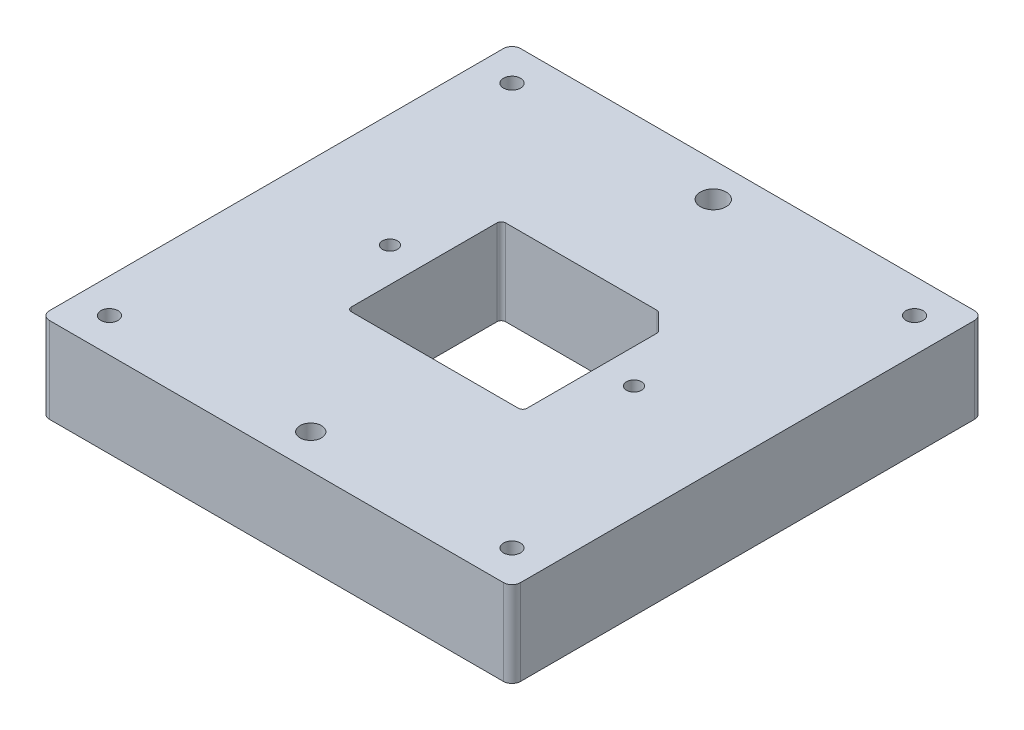
from build123d import *

# Parameters (mm, degrees)
CROQUIS1_W              = 110
CROQUIS1_H              = 110
SALIENTE_EXTRUIR1_DEPTH = 20
REDONDEO1_R             = 2
REDONDEO2_R             = 2
CROQUIS2_R              = 2
CORTAR_EXTRUIR1_DEPTH   = 20
CROQUIS3_R              = 4
CORTAR_EXTRUIR2_DEPTH   = 10
CROQUIS4_R              = 2.5
CROQUIS4_R_2            = 3
CORTAR_EXTRUIR3_DEPTH   = 10
CROQUIS5_R              = 1.75
CORTAR_EXTRUIR4_DEPTH   = 10
CORTAR_EXTRUIR5_DEPTH   = 23
CROQUIS10_R             = 1.75
CORTAR_EXTRUIR6_DEPTH   = 23
CORTAR_EXTRUIR7_DEPTH   = 23
CROQUIS12_R             = 2.5
CROQUIS12_R_2           = 3
CORTAR_EXTRUIR8_DEPTH   = 6
SALIENTE_EXTRUIR2_REACH = 82.312
CROQUIS13_R             = 3.5
CROQUIS14_R             = 1.75
CORTAR_EXTRUIR9_DEPTH   = 20
CROQUIS15_R             = 3
CORTAR_EXTRUIR10_DEPTH  = 6.3
CROQUIS23_R             = 4.917029705
SALIENTE_EXTRUIR4_DEPTH = 20
CROQUIS24_R             = 1.75
CORTAR_EXTRUIR12_DEPTH  = 20
CROQUIS25_R             = 3
CORTAR_EXTRUIR13_DEPTH  = 6.3
CROQUIS26_R             = 3
CORTAR_EXTRUIR14_DEPTH  = 6.3
CORTAR_EXTRUIR15_DEPTH  = 10
CROQUIS28_R             = 1.75
CORTAR_EXTRUIR16_DEPTH  = 20
CROQUIS29_W             = 24.147685667
CROQUIS29_H             = 8.546652792
SALIENTE_EXTRUIR5_DEPTH = 20


with BuildPart() as part:
    # Croquis1 → Saliente-Extruir1 (new body)
    with BuildSketch(Plane(origin=(0, 0, 0), x_dir=(1, 0, 0), z_dir=(0, 1, 0))):
        Rectangle(CROQUIS1_W, CROQUIS1_H)
    extrude(amount=SALIENTE_EXTRUIR1_DEPTH)

    # Redondeo1
    redondeo1_edges = [part.edges().sort_by_distance(p)[0] for p in [
        (55, 10, 55),
    ]]
    fillet(redondeo1_edges, radius=REDONDEO1_R)

    # Redondeo2
    redondeo2_edges = [part.edges().sort_by_distance(p)[0] for p in [
        (-55, 10, 55),
        (-55, 10, -55),
        (55, 10, -55),
    ]]
    fillet(redondeo2_edges, radius=REDONDEO2_R)

    # Croquis2 → Cortar-Extruir1 (cut)
    with BuildSketch(Plane.XZ):
        with Locations(Location((-47, 47, 0), (0, 0, 270))):
            Circle(CROQUIS2_R)
        with Locations(Location((47, 47, 0), (0, 0, 270))):
            Circle(CROQUIS2_R)
        with Locations(Location((47, -47, 0), (0, 0, 270))):
            Circle(CROQUIS2_R)
        with Locations(Location((-47, -47, 0), (0, 0, 270))):
            Circle(CROQUIS2_R)
    extrude(amount=-CORTAR_EXTRUIR1_DEPTH, mode=Mode.SUBTRACT)

    # Croquis3 → Cortar-Extruir2 (cut)
    with BuildSketch(Plane.XZ):
        with Locations(Location((47, 47, 0), (0, 0, 270))):
            Circle(CROQUIS3_R)
        with Locations(Location((-47, 47, 0), (0, 0, 90))):
            Circle(CROQUIS3_R)
        with Locations(Location((-47, -47, 0), (0, 0, 270))):
            Circle(CROQUIS3_R)
        with Locations(Location((47, -47, 0), (0, 0, 90))):
            Circle(CROQUIS3_R)
    extrude(amount=-CORTAR_EXTRUIR2_DEPTH, mode=Mode.SUBTRACT)

    # Croquis4 → Cortar-Extruir3 (cut)
    with BuildSketch(Plane.XZ):
        with Locations(Location((0, 47, 0), (0, 0, 270))):
            Circle(CROQUIS4_R)
        with Locations(Location((1.818078454, -47, 0), (0, 0, 270))):
            Circle(CROQUIS4_R_2)
    extrude(amount=-CORTAR_EXTRUIR3_DEPTH, mode=Mode.SUBTRACT)

    # Croquis5 → Cortar-Extruir4 (cut)
    with BuildSketch(Plane.XZ.offset(-10)):
        with Locations((0, 47)):
            Circle(CROQUIS5_R)
        with Locations((1.818078454, -47)):
            Circle(CROQUIS5_R)
        with BuildLine():
            Line((20.207106781, -14.050252532), (16.550252532, -17.707106781))
            ThreePointArc((16.550252532, -17.707106781), (16.225829183, -17.923879533), (15.843145751, -18))
            Line((15.843145751, -18), (-19.5, -18))
            ThreePointArc((-19.5, -18), (-20.207106781, -17.707106781), (-20.5, -17))
            Line((-20.5, -17), (-20.5, 17))
            ThreePointArc((-20.5, 17), (-20.207106781, 17.707106781), (-19.5, 18))
            Line((-19.5, 18), (19.5, 18))
            ThreePointArc((19.5, 18), (20.207106781, 17.707106781), (20.5, 17))
            Line((20.5, 17), (20.5, -13.343145751))
            ThreePointArc((20.5, -13.343145751), (20.423879533, -13.725829183), (20.207106781, -14.050252532))
        make_face()
    extrude(amount=CORTAR_EXTRUIR4_DEPTH, mode=Mode.SUBTRACT)

    # Croquis8 → Cortar-Extruir5 (cut)
    # profile 1 of 6: a face of its own
    with BuildSketch(Plane(origin=(0, 20, 0), x_dir=(1, 0, 0), z_dir=(0, 1, 0))):
        Polygon((-5.179479891, -37.773450824), (-3.474351686, -37.773450824), (-3.474351686, -38.132425183), (-4.865377327, -38.132425183), (-4.865377327, -39.20934826), (-3.474351686, -39.20934826), (-3.474351686, -39.568322619), (-4.865377327, -39.568322619), (-4.865377327, -41.273450824), (-5.179479891, -41.273450824), align=None)
    # profile 2 of 6: a face of its own
    with BuildSketch(Plane(origin=(0, 20, 0), x_dir=(1, 0, 0), z_dir=(0, 1, 0))):
        with BuildLine():
            Line((-3.025633737, -38.715758517), (-2.711531173, -38.715758517))
            Line((-2.711531173, -38.715758517), (-2.711531173, -39.09226092))
            add(Edge.make_bspline(
                [(-2.711531173, -39.09226092), (-2.688342414, -39.057205092), (-2.643994093, -38.990161093), (-2.570281164, -38.901491792), (-2.494777833, -38.828076745), (-2.417122645, -38.769573226), (-2.336744545, -38.725760108), (-2.255407594, -38.693667073), (-2.171832124, -38.674689757), (-2.1156702, -38.672156098), (-2.087532776, -38.670886722)],
                knots=[0, 0, 0, 0, 1.2804753, 2.448899062, 3.506932113, 4.484331642, 5.4025378, 6.288909075, 7.142734305, 8, 8, 8, 8], degree=3))
            add(Edge.make_bspline(
                [(-2.087532776, -38.670886722), (-2.065706449, -38.672077248), (-2.020797364, -38.674526834), (-1.952814774, -38.691737659), (-1.882771322, -38.719215681), (-1.837628935, -38.745055904), (-1.814095276, -38.758526946)],
                knots=[0, 0, 0, 0, 0.901110191, 1.854092781, 2.881294221, 4, 4, 4, 4], degree=3))
            Line((-1.814095276, -38.758526946), (-1.986571237, -39.030562203))
            add(Edge.make_bspline(
                [(-1.986571237, -39.030562203), (-2.001680258, -39.023821936), (-2.030360073, -39.011027621), (-2.072314639, -38.995885611), (-2.110995976, -38.986969695), (-2.135639534, -38.985618978), (-2.147128128, -38.984989286)],
                knots=[0, 0, 0, 0, 1.180555205, 2.24091978, 3.179933427, 4, 4, 4, 4], degree=3))
            add(Edge.make_bspline(
                [(-2.147128128, -38.984989286), (-2.172333862, -38.986669323), (-2.223746252, -38.990096112), (-2.299230751, -39.01703492), (-2.372477957, -39.06056016), (-2.430649619, -39.108831272), (-2.475691872, -39.15537907), (-2.507832097, -39.196027472), (-2.537314844, -39.241606104), (-2.565485065, -39.291335788), (-2.591151359, -39.346065634), (-2.615106028, -39.405248847), (-2.636764891, -39.468953976), (-2.649115135, -39.513336496), (-2.655441429, -39.536071017)],
                knots=[0, 0, 0, 0, 1.125678352, 2.296057538, 3.5422874, 4.923748041, 5.663163013, 6.437101912, 7.23742474, 8.08941207, 8.991984279, 9.93940061, 10.944477711, 12, 12, 12, 12], degree=3))
            add(Edge.make_bspline(
                [(-2.655441429, -39.536071017), (-2.660173823, -39.55634819), (-2.670655714, -39.601260589), (-2.680847252, -39.676609114), (-2.69091677, -39.765632772), (-2.698013389, -39.868579365), (-2.704591431, -39.985191809), (-2.708301513, -40.115647755), (-2.711404654, -40.260081106), (-2.71148772, -40.361055459), (-2.711531173, -40.413875504)],
                knots=[0, 0, 0, 0, 0.566838948, 1.255505196, 2.06880316, 3.007127437, 4.065329342, 5.249902469, 6.561414163, 8, 8, 8, 8], degree=3))
            Line((-2.711531173, -40.413875504), (-2.711531173, -41.273450824))
            Line((-2.711531173, -41.273450824), (-3.025633737, -41.273450824))
            Line((-3.025633737, -41.273450824), (-3.025633737, -38.715758517))
        make_face()
    # profile 3 of 6: a face of its own
    with BuildSketch(Plane(origin=(0, 20, 0), x_dir=(1, 0, 0), z_dir=(0, 1, 0))):
        with BuildLine():
            Line((0.599165942, -40.465758517), (0.878212417, -40.612292972))
            add(Edge.make_bspline(
                [(0.878212417, -40.612292972), (0.855975821, -40.651736303), (0.812712213, -40.728477406), (0.738311465, -40.833909266), (0.660319393, -40.928756982), (0.575215425, -41.010486636), (0.485545746, -41.081738021), (0.390813091, -41.144075846), (0.290524273, -41.197194366), (0.184674548, -41.241946894), (0.072374997, -41.276356388), (-0.046646519, -41.300660609), (-0.172618015, -41.315683878), (-0.258964195, -41.317429019), (-0.303177808, -41.318322619)],
                knots=[0, 0, 0, 0, 1.120438281, 2.179929193, 3.190490725, 4.156257408, 5.095198341, 6.022838206, 6.959905092, 7.901321166, 8.864066838, 9.862729781, 10.905609505, 12, 12, 12, 12], degree=3))
            add(Edge.make_bspline(
                [(-0.303177808, -41.318322619), (-0.352319785, -41.317175444), (-0.448181547, -41.314937637), (-0.587721294, -41.295645173), (-0.719100712, -41.264172814), (-0.842312416, -41.220207273), (-0.957054668, -41.162779948), (-1.063555523, -41.092820467), (-1.162375049, -41.010688212), (-1.250399258, -40.915671768), (-1.329643141, -40.813989811), (-1.399568961, -40.708033927), (-1.458026392, -40.598070702), (-1.505579002, -40.484800178), (-1.543983867, -40.368936285), (-1.570750571, -40.249424817), (-1.586180319, -40.126589233), (-1.588544764, -40.043491897), (-1.589736301, -40.001615888)],
                knots=[0, 0, 0, 0, 1.145258523, 2.234067595, 3.276747158, 4.290159414, 5.277019952, 6.260822364, 7.254936242, 8.264827045, 9.274100331, 10.257902744, 11.220704747, 12.172965371, 13.118907548, 14.062713208, 15.023725156, 16, 16, 16, 16], degree=3))
            add(Edge.make_bspline(
                [(-1.589736301, -40.001615888), (-1.58867716, -39.962321058), (-1.586578082, -39.884443893), (-1.573347294, -39.769178349), (-1.549899001, -39.657149896), (-1.517722677, -39.548265448), (-1.476171431, -39.442707314), (-1.425339212, -39.340411251), (-1.365146834, -39.241486111), (-1.31867416, -39.179082977), (-1.295265147, -39.147649542)],
                knots=[0, 0, 0, 0, 1.024358464, 2.0301432, 3.019427413, 4.004406732, 4.986367066, 5.972626655, 6.978780325, 8, 8, 8, 8], degree=3))
            add(Edge.make_bspline(
                [(-1.295265147, -39.147649542), (-1.263557465, -39.109780672), (-1.201146518, -39.035242522), (-1.095590163, -38.937304196), (-0.981289966, -38.855260421), (-0.85967834, -38.787253285), (-0.729341866, -38.735579638), (-0.592032575, -38.697072055), (-0.446186989, -38.675494044), (-0.346481768, -38.672446211), (-0.295465468, -38.670886722)],
                knots=[0, 0, 0, 0, 1.030682036, 2.02871468, 2.997146059, 3.962720338, 4.930598197, 5.918074684, 6.934738563, 8, 8, 8, 8], degree=3))
            add(Edge.make_bspline(
                [(-0.295465468, -38.670886722), (-0.243017863, -38.672240771), (-0.140127617, -38.674897106), (0.009904504, -38.699523439), (0.151865221, -38.738575994), (0.285697725, -38.793729784), (0.411415586, -38.864889336), (0.528201636, -38.953031178), (0.638053148, -39.055449265), (0.701961727, -39.134212474), (0.734482449, -39.17429217)],
                knots=[0, 0, 0, 0, 1.056321875, 2.072262726, 3.055038591, 4.01806755, 4.982017516, 5.957941055, 6.960871419, 8, 8, 8, 8], degree=3))
            add(Edge.make_bspline(
                [(0.734482449, -39.17429217), (0.756609387, -39.204495752), (0.80071598, -39.264701871), (0.85596308, -39.362873028), (0.903920475, -39.465583622), (0.942253436, -39.574493919), (0.973292937, -39.688313499), (0.995749756, -39.807856044), (1.008919375, -39.933085955), (1.011508072, -40.018412511), (1.012827801, -40.061912363)],
                knots=[0, 0, 0, 0, 0.94817472, 1.890038105, 2.849395472, 3.817997239, 4.812318967, 5.836947057, 6.897266129, 8, 8, 8, 8], degree=3))
            Line((1.012827801, -40.061912363), (-1.275633737, -40.061912363))
            add(Edge.make_bspline(
                [(-1.275633737, -40.061912363), (-1.274094131, -40.095612827), (-1.271066557, -40.161883431), (-1.256951414, -40.258854214), (-1.23470264, -40.351227556), (-1.203433577, -40.438310598), (-1.165566732, -40.521240726), (-1.119181015, -40.599402762), (-1.063841461, -40.672440693), (-1.002115762, -40.74100783), (-0.933408666, -40.802068591), (-0.861125919, -40.856720368), (-0.784232354, -40.902525964), (-0.703334271, -40.939705854), (-0.618562486, -40.96881217), (-0.52989029, -40.988679991), (-0.437492174, -41.001987098), (-0.37450644, -41.003466763), (-0.342440628, -41.004220055)],
                knots=[0, 0, 0, 0, 1.094153842, 2.151609401, 3.174256925, 4.172055639, 5.149267565, 6.128595816, 7.11444997, 8.118368179, 9.117203808, 10.09244225, 11.054858984, 12.015122123, 12.976791628, 13.957293641, 14.960065497, 16, 16, 16, 16], degree=3))
            add(Edge.make_bspline(
                [(-0.342440628, -41.004220055), (-0.311089481, -41.003611998), (-0.24888279, -41.002405497), (-0.156241932, -40.990673586), (-0.065102405, -40.971703311), (0.024158578, -40.945813321), (0.109729424, -40.914236469), (0.188974974, -40.876133611), (0.26185519, -40.833983864), (0.329972157, -40.785774189), (0.39604315, -40.726766002), (0.461585636, -40.653130281), (0.53186229, -40.566042753), (0.575851882, -40.500497087), (0.599165942, -40.465758517)],
                knots=[0, 0, 0, 0, 0.99110716, 1.966546729, 2.947904876, 3.932708344, 4.903319531, 5.828989031, 6.710028674, 7.56322171, 8.463672341, 9.504779593, 10.677557249, 12, 12, 12, 12], degree=3))
        make_face()
        with BuildLine():
            add(Edge.make_bspline(
                [(0.698725237, -39.747809799), (0.687228613, -39.706146925), (0.665101311, -39.625959304), (0.618864947, -39.514918414), (0.566793406, -39.416230513), (0.505171675, -39.33065088), (0.435352949, -39.254647367), (0.354707766, -39.188228782), (0.264271873, -39.128811331), (0.164512732, -39.078658831), (0.058870947, -39.035968972), (-0.051735245, -39.007343857), (-0.164593033, -38.987734314), (-0.240927319, -38.985908206), (-0.279339667, -38.984989286)],
                knots=[0, 0, 0, 0, 1.154881502, 2.222775134, 3.210006277, 4.132804581, 5.035138423, 5.962687519, 6.919655026, 7.923214229, 8.944639381, 9.960483929, 10.97369054, 12, 12, 12, 12], degree=3))
            add(Edge.make_bspline(
                [(-0.279339667, -38.984989286), (-0.310689105, -38.985600957), (-0.372660354, -38.986810103), (-0.463961422, -38.998280233), (-0.551641121, -39.017240078), (-0.636346409, -39.043205034), (-0.716967277, -39.077813637), (-0.795162045, -39.118396863), (-0.868942442, -39.167938447), (-0.915083737, -39.205697302), (-0.938394154, -39.22477294)],
                knots=[0, 0, 0, 0, 1.04873581, 2.073130211, 3.073294108, 4.04793562, 5.032784715, 6.005352987, 6.992311501, 8, 8, 8, 8], degree=3))
            add(Edge.make_bspline(
                [(-0.938394154, -39.22477294), (-0.955087436, -39.239867255), (-0.98887057, -39.270414471), (-1.034011091, -39.323043678), (-1.077231564, -39.37979524), (-1.116565217, -39.442840365), (-1.152642803, -39.511461144), (-1.186402781, -39.585078779), (-1.216789193, -39.664251909), (-1.233885303, -39.719424348), (-1.242681013, -39.747809799)],
                knots=[0, 0, 0, 0, 0.879870761, 1.780643979, 2.707998968, 3.669668524, 4.684282772, 5.740141944, 6.837334558, 8, 8, 8, 8], degree=3))
            Line((-1.242681013, -39.747809799), (0.698725237, -39.747809799))
        make_face(mode=Mode.SUBTRACT)
    # profile 4 of 6: a face of its own
    with BuildSketch(Plane(origin=(0, 20, 0), x_dir=(1, 0, 0), z_dir=(0, 1, 0))):
        with BuildLine():
            Line((1.64103293, -38.715758517), (1.955135494, -38.715758517))
            Line((1.955135494, -38.715758517), (1.955135494, -39.177096658))
            add(Edge.make_bspline(
                [(1.955135494, -39.177096658), (1.988673129, -39.135253935), (2.05375408, -39.054056671), (2.162138413, -38.947336097), (2.276682313, -38.859390872), (2.396684317, -38.789287078), (2.522307327, -38.736440452), (2.652785597, -38.698274521), (2.788900303, -38.675389692), (2.88146474, -38.672399462), (2.928292545, -38.670886722)],
                knots=[0, 0, 0, 0, 1.12780773, 2.188550248, 3.19190651, 4.159438251, 5.104880172, 6.052711206, 7.014878035, 8, 8, 8, 8], degree=3))
            add(Edge.make_bspline(
                [(2.928292545, -38.670886722), (2.975623179, -38.672631917), (3.068260647, -38.676047686), (3.203138708, -38.703064377), (3.329112102, -38.749209632), (3.445731658, -38.812421702), (3.550858871, -38.891028176), (3.643183723, -38.982605957), (3.71954697, -39.087942041), (3.770744333, -39.185665197), (3.804469981, -39.272353991), (3.825702318, -39.346600741), (3.8437333, -39.429318892), (3.859365048, -39.520258482), (3.869942159, -39.620056672), (3.878284451, -39.728304364), (3.884263145, -39.844966494), (3.884500352, -39.925653122), (3.884622673, -39.96726092)],
                knots=[0, 0, 0, 0, 1.235846778, 2.418850247, 3.575807741, 4.728682307, 5.871620074, 6.994088408, 8.11269785, 9.256955736, 9.865816715, 10.540099792, 11.271859618, 12.076849838, 12.949306005, 13.892391288, 14.913166135, 16, 16, 16, 16], degree=3))
            Line((3.884622673, -39.96726092), (3.884622673, -41.273450824))
            Line((3.884622673, -41.273450824), (3.570520109, -41.273450824))
            Line((3.570520109, -41.273450824), (3.570520109, -40.070325824))
            add(Edge.make_bspline(
                [(3.570520109, -40.070325824), (3.570326901, -40.035503379), (3.569957327, -39.968893969), (3.56879168, -39.873524945), (3.565981874, -39.787038367), (3.562033561, -39.709641), (3.55625453, -39.641407163), (3.550231899, -39.582197886), (3.542866922, -39.532088344), (3.536304009, -39.501923262), (3.533360654, -39.488394735)],
                knots=[0, 0, 0, 0, 1.430800155, 2.736877192, 3.918605307, 4.986035426, 5.920637409, 6.731861385, 7.431261377, 8, 8, 8, 8], degree=3))
            add(Edge.make_bspline(
                [(3.533360654, -39.488394735), (3.522735122, -39.44868355), (3.502284262, -39.372251805), (3.451750279, -39.268577452), (3.387936098, -39.180379265), (3.310038248, -39.108202543), (3.218809173, -39.052031706), (3.11450203, -39.013057752), (2.998123389, -38.988681482), (2.916269007, -38.98625435), (2.873605045, -38.984989286)],
                knots=[0, 0, 0, 0, 1.084156227, 2.086665306, 3.027808233, 3.945421172, 4.874247719, 5.839848303, 6.874090471, 8, 8, 8, 8], degree=3))
            add(Edge.make_bspline(
                [(2.873605045, -38.984989286), (2.848337361, -38.985465291), (2.798333268, -38.986407291), (2.724183296, -38.995858589), (2.652259123, -39.011317045), (2.581838914, -39.032185683), (2.514331121, -39.060847952), (2.447566829, -39.093377322), (2.384060065, -39.133925534), (2.322456668, -39.179116155), (2.26514386, -39.229195363), (2.211815522, -39.282039873), (2.164277502, -39.338315477), (2.121208826, -39.397115424), (2.084030563, -39.459247262), (2.051577475, -39.524111569), (2.02404178, -39.591793717), (2.010359088, -39.638768779), (2.003512897, -39.66227294)],
                knots=[0, 0, 0, 0, 1.023777757, 2.026029729, 3.023749952, 4.003683103, 4.997618607, 5.993177895, 7.010360494, 8.046726602, 9.087585522, 10.09234134, 11.086953743, 12.070360549, 13.043493632, 14.017870808, 15.008233677, 16, 16, 16, 16], degree=3))
            add(Edge.make_bspline(
                [(2.003512897, -39.66227294), (1.999573249, -39.679528143), (1.99099684, -39.717091817), (1.98173366, -39.778736237), (1.973326085, -39.850046212), (1.966289126, -39.930938529), (1.96198371, -40.021696404), (1.957289313, -40.121932242), (1.955580252, -40.23204573), (1.955287898, -40.308707423), (1.955135494, -40.348671177)],
                knots=[0, 0, 0, 0, 0.615963638, 1.340920617, 2.168419149, 3.115676021, 4.16674242, 5.331190069, 6.6087489, 8, 8, 8, 8], degree=3))
            Line((1.955135494, -40.348671177), (1.955135494, -41.273450824))
            Line((1.955135494, -41.273450824), (1.64103293, -41.273450824))
            Line((1.64103293, -41.273450824), (1.64103293, -38.715758517))
        make_face()
    # profile 5 of 6: a face of its own
    with BuildSketch(Plane(origin=(0, 20, 0), x_dir=(1, 0, 0), z_dir=(0, 1, 0))):
        Polygon((4.916673955, -37.683707235), (5.230776519, -37.683707235), (5.230776519, -38.715758517), (5.679494468, -38.715758517), (5.679494468, -39.029861081), (5.230776519, -39.029861081), (5.230776519, -41.273450824), (4.916673955, -41.273450824), (4.916673955, -39.029861081), (4.467956006, -39.029861081), (4.467956006, -38.715758517), (4.916673955, -38.715758517), align=None)
    # profile 6 of 6: a face of its own
    with BuildSketch(Plane(origin=(0, 20, 0), x_dir=(1, 0, 0), z_dir=(0, 1, 0))):
        with BuildLine():
            Line((8.31711466, -40.465758517), (8.596161135, -40.612292972))
            add(Edge.make_bspline(
                [(8.596161135, -40.612292972), (8.573924539, -40.651736303), (8.530660931, -40.728477406), (8.456260183, -40.833909266), (8.37826811, -40.928756982), (8.293164142, -41.010486636), (8.203494464, -41.081738021), (8.108761809, -41.144075846), (8.008472991, -41.197194366), (7.902623266, -41.241946894), (7.790323715, -41.276356388), (7.671302199, -41.300660609), (7.545330703, -41.315683878), (7.458984523, -41.317429019), (7.41477091, -41.318322619)],
                knots=[0, 0, 0, 0, 1.120438281, 2.179929193, 3.190490725, 4.156257408, 5.095198341, 6.022838206, 6.959905092, 7.901321166, 8.864066838, 9.862729781, 10.905609505, 12, 12, 12, 12], degree=3))
            add(Edge.make_bspline(
                [(7.41477091, -41.318322619), (7.365628933, -41.317175444), (7.269767171, -41.314937637), (7.130227424, -41.295645173), (6.998848006, -41.264172814), (6.875636302, -41.220207273), (6.76089405, -41.162779948), (6.654393195, -41.092820467), (6.555573669, -41.010688212), (6.46754946, -40.915671768), (6.388305577, -40.813989811), (6.318379757, -40.708033927), (6.259922326, -40.598070702), (6.212369716, -40.484800178), (6.173964851, -40.368936285), (6.147198147, -40.249424817), (6.131768399, -40.126589233), (6.129403954, -40.043491897), (6.128212417, -40.001615888)],
                knots=[0, 0, 0, 0, 1.145258523, 2.234067595, 3.276747158, 4.290159414, 5.277019952, 6.260822364, 7.254936242, 8.264827045, 9.274100331, 10.257902744, 11.220704747, 12.172965371, 13.118907548, 14.062713208, 15.023725156, 16, 16, 16, 16], degree=3))
            add(Edge.make_bspline(
                [(6.128212417, -40.001615888), (6.129271558, -39.962321058), (6.131370636, -39.884443893), (6.144601424, -39.769178349), (6.168049717, -39.657149896), (6.200226041, -39.548265448), (6.241777287, -39.442707314), (6.292609506, -39.340411251), (6.352801884, -39.241486111), (6.399274558, -39.179082977), (6.422683571, -39.147649542)],
                knots=[0, 0, 0, 0, 1.024358464, 2.0301432, 3.019427413, 4.004406732, 4.986367066, 5.972626655, 6.978780325, 8, 8, 8, 8], degree=3))
            add(Edge.make_bspline(
                [(6.422683571, -39.147649542), (6.454391253, -39.109780672), (6.5168022, -39.035242522), (6.622358555, -38.937304196), (6.736658752, -38.855260421), (6.858270378, -38.787253285), (6.988606852, -38.735579638), (7.125916143, -38.697072055), (7.271761729, -38.675494044), (7.37146695, -38.672446211), (7.42248325, -38.670886722)],
                knots=[0, 0, 0, 0, 1.030682036, 2.02871468, 2.997146059, 3.962720338, 4.930598197, 5.918074684, 6.934738563, 8, 8, 8, 8], degree=3))
            add(Edge.make_bspline(
                [(7.42248325, -38.670886722), (7.474930855, -38.672240771), (7.577821101, -38.674897106), (7.727853222, -38.699523439), (7.869813939, -38.738575994), (8.003646443, -38.793729784), (8.129364304, -38.864889336), (8.246150354, -38.953031178), (8.356001866, -39.055449265), (8.419910445, -39.134212474), (8.452431167, -39.17429217)],
                knots=[0, 0, 0, 0, 1.056321875, 2.072262726, 3.055038591, 4.01806755, 4.982017516, 5.957941055, 6.960871419, 8, 8, 8, 8], degree=3))
            add(Edge.make_bspline(
                [(8.452431167, -39.17429217), (8.474558105, -39.204495752), (8.518664698, -39.264701871), (8.573911798, -39.362873028), (8.621869193, -39.465583622), (8.660202154, -39.574493919), (8.691241655, -39.688313499), (8.713698474, -39.807856044), (8.726868093, -39.933085955), (8.72945679, -40.018412511), (8.730776519, -40.061912363)],
                knots=[0, 0, 0, 0, 0.94817472, 1.890038105, 2.849395472, 3.817997239, 4.812318967, 5.836947057, 6.897266129, 8, 8, 8, 8], degree=3))
            Line((8.730776519, -40.061912363), (6.442314981, -40.061912363))
            add(Edge.make_bspline(
                [(6.442314981, -40.061912363), (6.443854587, -40.095612827), (6.446882161, -40.161883431), (6.460997304, -40.258854214), (6.483246078, -40.351227556), (6.514515141, -40.438310598), (6.552381986, -40.521240726), (6.598767703, -40.599402762), (6.654107257, -40.672440693), (6.715832956, -40.74100783), (6.784540052, -40.802068591), (6.856822799, -40.856720368), (6.933716364, -40.902525964), (7.014614447, -40.939705854), (7.099386232, -40.96881217), (7.188058427, -40.988679991), (7.280456544, -41.001987098), (7.343442278, -41.003466763), (7.37550809, -41.004220055)],
                knots=[0, 0, 0, 0, 1.094153842, 2.151609401, 3.174256925, 4.172055639, 5.149267565, 6.128595816, 7.11444997, 8.118368179, 9.117203808, 10.09244225, 11.054858984, 12.015122123, 12.976791628, 13.957293641, 14.960065497, 16, 16, 16, 16], degree=3))
            add(Edge.make_bspline(
                [(7.37550809, -41.004220055), (7.406859237, -41.003611998), (7.469065928, -41.002405497), (7.561706786, -40.990673586), (7.652846313, -40.971703311), (7.742107296, -40.945813321), (7.827678142, -40.914236469), (7.906923692, -40.876133611), (7.979803908, -40.833983864), (8.047920875, -40.785774189), (8.113991868, -40.726766002), (8.179534354, -40.653130281), (8.249811008, -40.566042753), (8.2938006, -40.500497087), (8.31711466, -40.465758517)],
                knots=[0, 0, 0, 0, 0.99110716, 1.966546729, 2.947904876, 3.932708344, 4.903319531, 5.828989031, 6.710028674, 7.56322171, 8.463672341, 9.504779593, 10.677557249, 12, 12, 12, 12], degree=3))
        make_face()
        with BuildLine():
            add(Edge.make_bspline(
                [(8.416673955, -39.747809799), (8.405177331, -39.706146925), (8.383050029, -39.625959304), (8.336813665, -39.514918414), (8.284742124, -39.416230513), (8.223120393, -39.33065088), (8.153301667, -39.254647367), (8.072656484, -39.188228782), (7.982220591, -39.128811331), (7.88246145, -39.078658831), (7.776819665, -39.035968972), (7.666213473, -39.007343857), (7.553355685, -38.987734314), (7.477021399, -38.985908206), (7.438609051, -38.984989286)],
                knots=[0, 0, 0, 0, 1.154881502, 2.222775134, 3.210006277, 4.132804581, 5.035138423, 5.962687519, 6.919655026, 7.923214229, 8.944639381, 9.960483929, 10.97369054, 12, 12, 12, 12], degree=3))
            add(Edge.make_bspline(
                [(7.438609051, -38.984989286), (7.407259613, -38.985600957), (7.345288364, -38.986810103), (7.253987296, -38.998280233), (7.166307597, -39.017240078), (7.081602309, -39.043205034), (7.000981441, -39.077813637), (6.922786672, -39.118396863), (6.849006276, -39.167938447), (6.802864981, -39.205697302), (6.779554564, -39.22477294)],
                knots=[0, 0, 0, 0, 1.04873581, 2.073130211, 3.073294108, 4.04793562, 5.032784715, 6.005352987, 6.992311501, 8, 8, 8, 8], degree=3))
            add(Edge.make_bspline(
                [(6.779554564, -39.22477294), (6.762861282, -39.239867255), (6.729078148, -39.270414471), (6.683937626, -39.323043678), (6.640717154, -39.37979524), (6.601383501, -39.442840365), (6.565305915, -39.511461144), (6.531545937, -39.585078779), (6.501159525, -39.664251909), (6.484063415, -39.719424348), (6.475267705, -39.747809799)],
                knots=[0, 0, 0, 0, 0.879870761, 1.780643979, 2.707998968, 3.669668524, 4.684282772, 5.740141944, 6.837334558, 8, 8, 8, 8], degree=3))
            Line((6.475267705, -39.747809799), (8.416673955, -39.747809799))
        make_face(mode=Mode.SUBTRACT)
    extrude(amount=-CORTAR_EXTRUIR5_DEPTH, mode=Mode.SUBTRACT)


with BuildPart() as cortar_extruir5_piece_1:
    # of the separate pieces the step leaves, piece 1, a body of its own (cortar_extruir5_pieces)
    add(part.part.solids().sort_by_distance((55, 0, -53))[0])

    # Croquis10 → Cortar-Extruir6 (cut)
    with BuildSketch(Plane.XZ.offset(-10)):
        with Locations(Location((0, 47, 0), (0, 0, 270))):
            Circle(CROQUIS10_R)
        with Locations(Location((1.818078454, -47, 0), (0, 0, 270))):
            Circle(CROQUIS10_R)
    extrude(amount=-CORTAR_EXTRUIR6_DEPTH, mode=Mode.SUBTRACT)

    # Croquis11 → Cortar-Extruir7 (cut)
    with BuildSketch(Plane.XZ.offset(-10)):
        with BuildLine():
            Line((-14, 13.5), (14, 13.5))
            ThreePointArc((14, 13.5), (14.707106781, 13.207106781), (15, 12.5))
            Line((15, 12.5), (15, -12.5))
            ThreePointArc((15, -12.5), (14.707106781, -13.207106781), (14, -13.5))
            Line((14, -13.5), (-14, -13.5))
            ThreePointArc((-14, -13.5), (-14.707106781, -13.207106781), (-15, -12.5))
            Line((-15, -12.5), (-15, 12.5))
            ThreePointArc((-15, 12.5), (-14.707106781, 13.207106781), (-14, 13.5))
        make_face()
    extrude(amount=-CORTAR_EXTRUIR7_DEPTH, mode=Mode.SUBTRACT)

    # Croquis12 → Cortar-Extruir8 (cut)
    with BuildSketch(Plane(origin=(0, 20, 0), x_dir=(1, 0, 0), z_dir=(0, 1, 0))):
        with Locations(Location((0, -47, 0), (0, 0, 90))):
            Circle(CROQUIS12_R)
        with Locations(Location((1.818078454, 47, 0), (0, 0, 90))):
            Circle(CROQUIS12_R_2)
    extrude(amount=-CORTAR_EXTRUIR8_DEPTH, mode=Mode.SUBTRACT)

    # Saliente-Extruir2: up to this face of the body (flat: up to its plane)
    saliente_extruir2_end = Plane(cortar_extruir5_piece_1.part.faces().sort_by_distance((53.444365079, 20, 0))[0])
    # Croquis13 → Saliente-Extruir2 (add, up to the picked face)
    with BuildSketch(Plane.XZ, mode=Mode.PRIVATE) as saliente_extruir2_sk1:
        with Locations((0, -47)):
            Circle(CROQUIS13_R)
    saliente_extruir2_tool1 = split(extrude(saliente_extruir2_sk1.sketch, amount=-SALIENTE_EXTRUIR2_REACH, mode=Mode.PRIVATE), bisect_by=saliente_extruir2_end, keep=Keep.BOTH, mode=Mode.PRIVATE)
    add(saliente_extruir2_tool1.solids().sort_by(Axis((0, 0, -47), (0, 1, 0)))[0])

    # Croquis14 → Cortar-Extruir9 (cut)
    with BuildSketch(Plane.XZ):
        with Locations(Location((0, -47, 0), (0, 0, 270))):
            Circle(CROQUIS14_R)
    extrude(amount=-CORTAR_EXTRUIR9_DEPTH, mode=Mode.SUBTRACT)

    # Croquis15 → Cortar-Extruir10 (cut)
    with BuildSketch(Plane(origin=(0, 20, 0), x_dir=(1, 0, 0), z_dir=(0, 1, 0))):
        with Locations(Location((0, 47, 0), (0, 0, 270))):
            Circle(CROQUIS15_R)
    extrude(amount=-CORTAR_EXTRUIR10_DEPTH, mode=Mode.SUBTRACT)

    # Croquis23 → Saliente-Extruir4 (add)
    with BuildSketch(Plane(origin=(0, 20, 0), x_dir=(1, 0, 0), z_dir=(0, 1, 0))):
        with Locations((0, 47)):
            Circle(CROQUIS23_R)
    extrude(amount=-SALIENTE_EXTRUIR4_DEPTH)

    # Croquis24 → Cortar-Extruir12 (cut)
    with BuildSketch(Plane(origin=(0, 20, 0), x_dir=(1, 0, 0), z_dir=(0, 1, 0))):
        with Locations(Location((0, 47, 0), (0, 0, 270))):
            Circle(CROQUIS24_R)
    extrude(amount=-CORTAR_EXTRUIR12_DEPTH, mode=Mode.SUBTRACT)

    # Croquis25 → Cortar-Extruir13 (cut)
    with BuildSketch(Plane(origin=(0, 20, 0), x_dir=(1, 0, 0), z_dir=(0, 1, 0))):
        with Locations(Location((0, 47, 0), (0, 0, 270))):
            Circle(CROQUIS25_R)
    extrude(amount=-CORTAR_EXTRUIR13_DEPTH, mode=Mode.SUBTRACT)

    # Croquis26 → Cortar-Extruir14 (cut)
    with BuildSketch(Plane.XZ):
        with Locations(Location((0, -47, 0), (0, 0, 90))):
            Circle(CROQUIS26_R)
    extrude(amount=-CORTAR_EXTRUIR14_DEPTH, mode=Mode.SUBTRACT)

    # Croquis27 → Cortar-Extruir15 (cut)
    with BuildSketch(Plane.XZ.offset(-10)):
        with BuildLine():
            Line((20.5, -13.343145751), (20.5, 17))
            ThreePointArc((20.5, 17), (20.207106781, 17.707106781), (19.5, 18))
            Line((19.5, 18), (-19.5, 18))
            ThreePointArc((-19.5, 18), (-20.207106781, 17.707106781), (-20.5, 17))
            Line((-20.5, 17), (-20.5, -17))
            ThreePointArc((-20.5, -17), (-20.207106781, -17.707106781), (-19.5, -18))
            Line((-19.5, -18), (15.843145751, -18))
            ThreePointArc((15.843145751, -18), (16.225829183, -17.923879533), (16.550252532, -17.707106781))
            Line((16.550252532, -17.707106781), (20.207106781, -14.050252532))
            ThreePointArc((20.207106781, -14.050252532), (20.423879533, -13.725829183), (20.5, -13.343145751))
        make_face()
    extrude(amount=-CORTAR_EXTRUIR15_DEPTH, mode=Mode.SUBTRACT)

    # Croquis28 → Cortar-Extruir16 (cut)
    with BuildSketch(Plane(origin=(0, 20, 0), x_dir=(1, 0, 0), z_dir=(0, 1, 0))):
        with Locations(Location((-28.5, 1.648e-06, 0), (0, 0, 270))):
            Circle(CROQUIS28_R)
        with Locations(Location((28.5, 0, 0), (0, 0, 270))):
            Circle(CROQUIS28_R)
    extrude(amount=-CORTAR_EXTRUIR16_DEPTH, mode=Mode.SUBTRACT)

    # Croquis29 → Saliente-Extruir5 (add)
    with BuildSketch(Plane(origin=(0, 20, 0), x_dir=(1, 0, 0), z_dir=(0, 1, 0))):
        with Locations((2.645392531, -38.83181467)):
            Rectangle(CROQUIS29_W, CROQUIS29_H)
    extrude(amount=-SALIENTE_EXTRUIR5_DEPTH)


with BuildPart() as cortar_extruir5_piece_2:
    # of the separate pieces the step leaves, piece 2, a body of its own (cortar_extruir5_pieces)
    add(part.part.solids().sort_by_distance((6.779554564, 0, 39.22477294))[0])


with BuildPart() as cortar_extruir5_piece_3:
    # of the separate pieces the step leaves, piece 3, a body of its own (cortar_extruir5_pieces)
    add(part.part.solids().sort_by_distance((-0.938394154, 0, 39.22477294))[0])


solid = cortar_extruir5_piece_1.part
